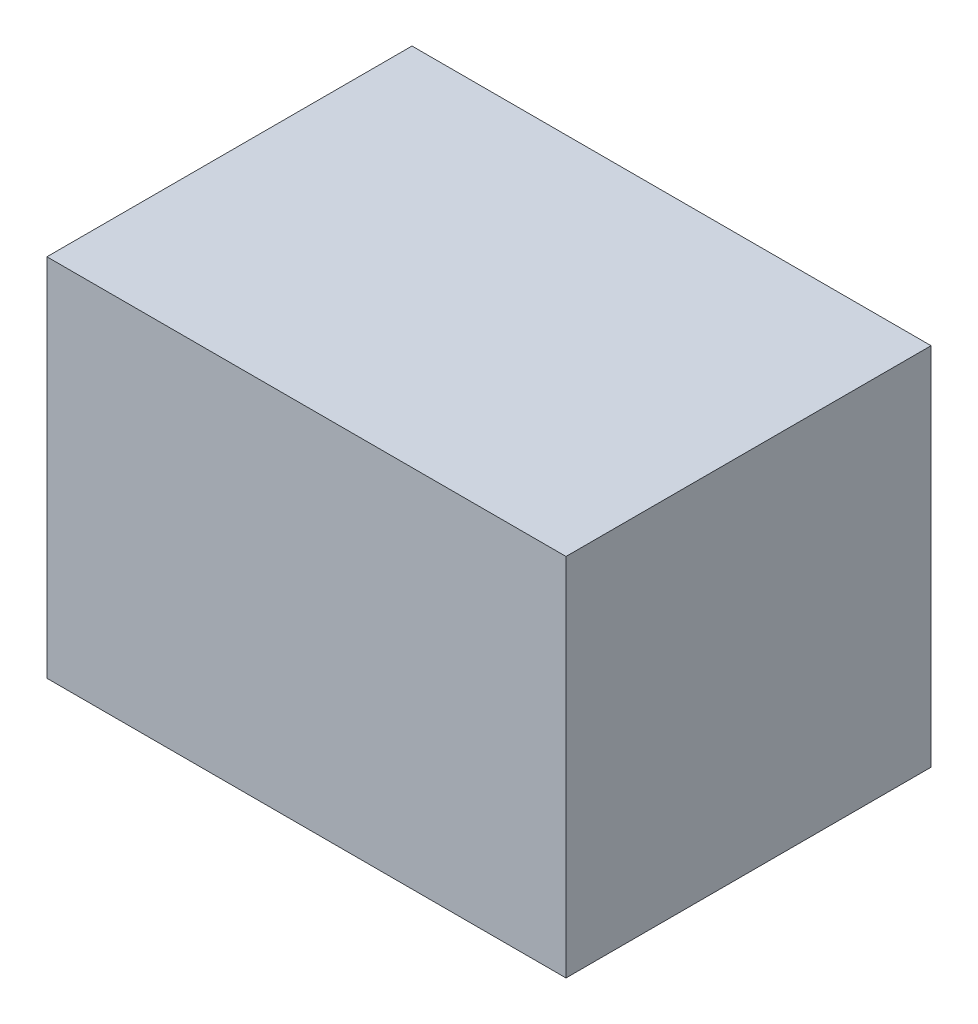
from build123d import *

# Parameters (mm, degrees)
SKETCH3_W           = 19
SKETCH3_H           = 64
SKETCH3_W_2         = 72
BOSS_EXTRUDE1_DEPTH = 64


with BuildPart() as part:
    # Sketch3 → Boss-Extrude1 (new body)
    with BuildSketch(Plane(origin=(0, 0, 0), x_dir=(1, 0, 0), z_dir=(0, 1, 0))):
        with Locations((81.5, 32)):
            Rectangle(SKETCH3_W, SKETCH3_H)
        with Locations((36, 32)):
            Rectangle(SKETCH3_W_2, SKETCH3_H)
    extrude(amount=BOSS_EXTRUDE1_DEPTH)


solid = part.part
